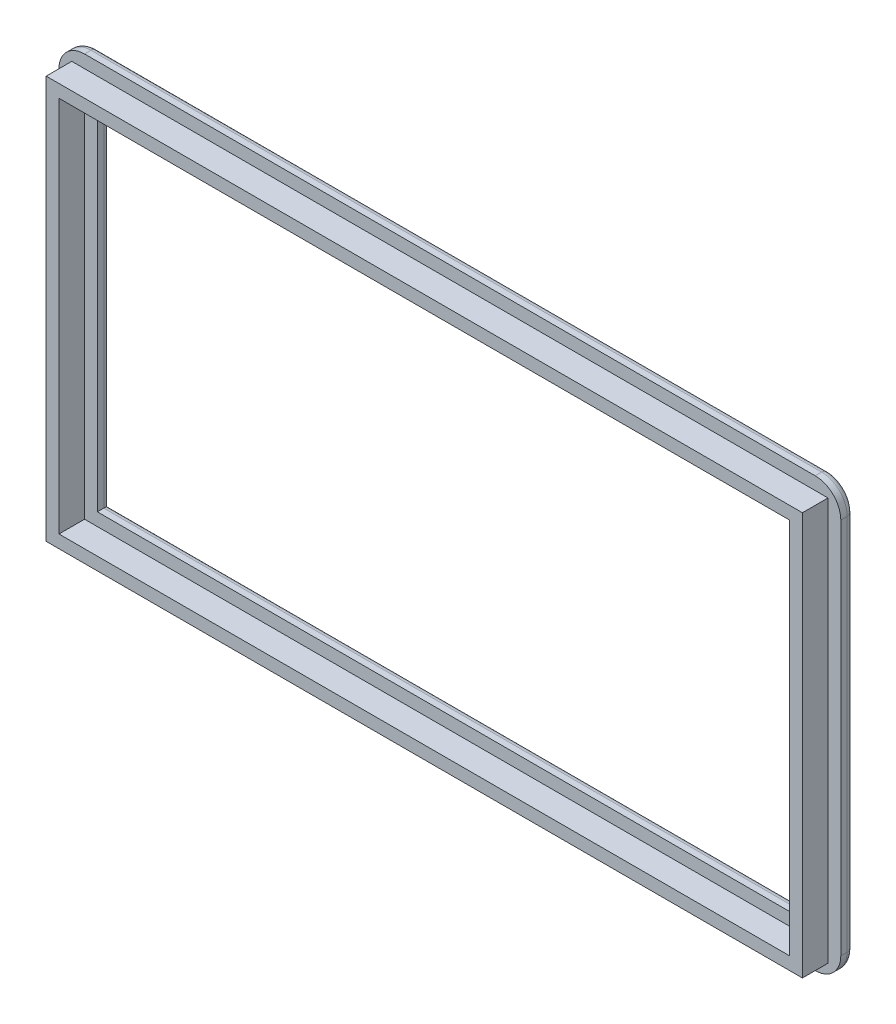
from build123d import *

# Parameters (mm, degrees)
SKETCH1_W           = 55.1
SKETCH1_H           = 27.49
BOSS_EXTRUDE1_DEPTH = 1
FILLET2_R           = 0.5
SKETCH3_W           = 59.1
SKETCH3_H           = 31.49
SKETCH3_W_2         = 57.1
SKETCH3_H_2         = 29.49
BOSS_EXTRUDE2_DEPTH = 2


with BuildPart() as part:
    # Sketch1 → Boss-Extrude1 (new body)
    with BuildSketch(Plane.XY):
        with BuildLine():
            Line((-28.55, 16.745), (28.55, 16.745))
            ThreePointArc((28.55, 16.745), (29.964213562, 16.159213562), (30.55, 14.745))
            Line((30.55, 14.745), (30.55, -14.745))
            ThreePointArc((30.55, -14.745), (29.964213562, -16.159213562), (28.55, -16.745))
            Line((28.55, -16.745), (-28.55, -16.745))
            ThreePointArc((-28.55, -16.745), (-29.964213562, -16.159213562), (-30.55, -14.745))
            Line((-30.55, -14.745), (-30.55, 14.745))
            ThreePointArc((-30.55, 14.745), (-29.964213562, 16.159213562), (-28.55, 16.745))
        make_face()
        Rectangle(SKETCH1_W, SKETCH1_H, mode=Mode.SUBTRACT)
    extrude(amount=BOSS_EXTRUDE1_DEPTH)

    # Fillet2
    fillet2_edges = [part.edges().sort_by_distance(p)[0] for p in [
        (0, 16.745, 0),
        (29.964213562, 16.159213562, 0),
        (30.55, 0, 0),
        (29.964213562, -16.159213562, 0),
        (27.55, 0, 0),
        (0, 13.745, 0),
        (-27.55, 0, 0),
        (0, -13.745, 0),
        (0, -16.745, 0),
        (-29.964213562, -16.159213562, 0),
        (-30.55, 0, 0),
        (-29.964213562, 16.159213562, 0),
    ]]
    fillet(fillet2_edges, radius=FILLET2_R)

    # Sketch3 → Boss-Extrude2 (add)
    with BuildSketch(Plane.XY.offset(1)):
        Rectangle(SKETCH3_W, SKETCH3_H)
        Rectangle(SKETCH3_W_2, SKETCH3_H_2, mode=Mode.SUBTRACT)
    extrude(amount=BOSS_EXTRUDE2_DEPTH)


solid = part.part
